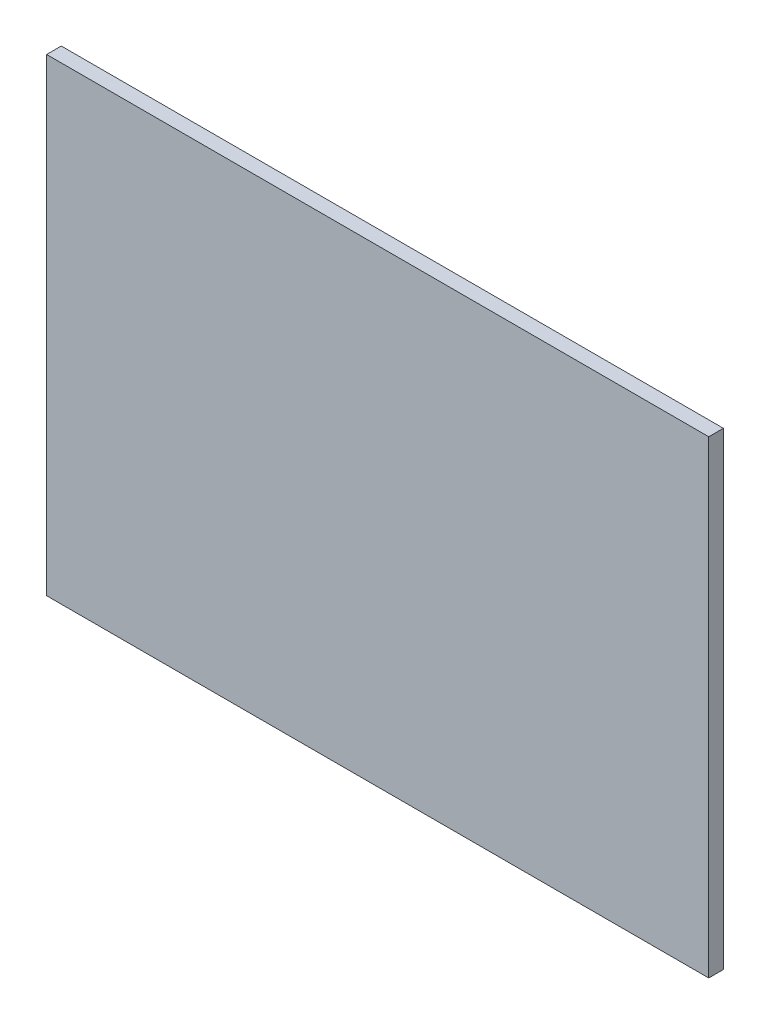
from build123d import *

# Parameters (mm, degrees)
SKETCH1_W           = 287.02
SKETCH1_H           = 203.2
BOSS_EXTRUDE1_DEPTH = 3.175


with BuildPart() as part:
    # Sketch1 → Boss-Extrude1 (new, symmetric)
    with BuildSketch(Plane.XY):
        Rectangle(SKETCH1_W, SKETCH1_H)
    extrude(amount=BOSS_EXTRUDE1_DEPTH, both=True)


solid = part.part
